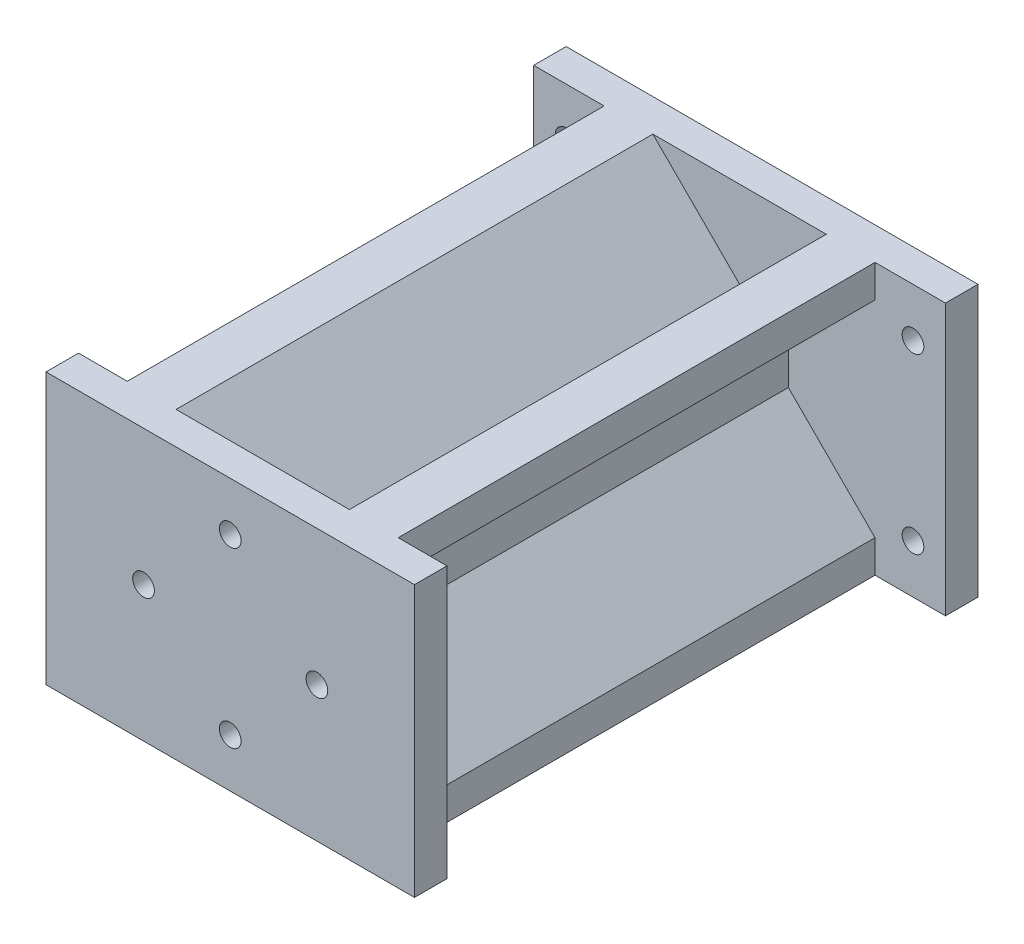
from build123d import *

# Parameters (mm, degrees)
SKETCH_1_W                       = 25
SKETCH_1_H                       = 25
EXTRUDE_1_DEPTH                  = 44
CUT_EXTRUDE_1_DEPTH              = 100
CUT_EXTRUDE_4_DEPTH              = 44
SKETCH_3_W                       = 38
SKETCH_3_H                       = 25
EXTRUDE_2_DEPTH                  = 3
SKETCH_4_R                       = 1
CUT_EXTRUDE_2_DEPTH              = 3
PATTERN_LINEAR_1_COUNT           = 2
PATTERN_LINEAR_1_PITCH           = 32
PATTERN_LINEAR_2_COUNT           = 2
PATTERN_LINEAR_2_PITCH           = 16
PATTERN_LINEAR_2_COPY_1_SKETCH_R = 1
PATTERN_LINEAR_2_COPY_1_DEPTH    = 3
SKETCH_6_W                       = 9.9
SKETCH_6_H                       = 5.8
EXTRUDE_3_DEPTH                  = 3
SKETCH_7_W                       = 34
SKETCH_7_H                       = 25
EXTRUDE_4_DEPTH                  = 3
SKETCH_8_R                       = 1
CUT_EXTRUDE_3_DEPTH              = 3
PATTERN_CIRCULAR_1_COUNT         = 4


with BuildPart() as part:
    # 草图1 → 凸台-拉伸1 (new body)
    with BuildSketch(Plane.XY):
        Rectangle(SKETCH_1_W, SKETCH_1_H)
    extrude(amount=EXTRUDE_1_DEPTH)

    # 草图2 → 切除-拉伸1 (cut)
    with BuildSketch(Plane(origin=(0, 0, 0), x_dir=(-1, 0, 0), z_dir=(0, 0, -1))):
        Polygon((-4.5, 1.5), (-12.5, 9.5), (-12.5, -9.5), (-4.5, -1.5), align=None)
    cut_extrude_1 = extrude(amount=-CUT_EXTRUDE_1_DEPTH, mode=Mode.SUBTRACT)

    # 镜向1: 切除-拉伸1 across plane
    add(cut_extrude_1.mirror(Plane(origin=(0, 0, 0), x_dir=(0, 0, 1), z_dir=(1, 0, 0))), mode=Mode.SUBTRACT)

    # 草图9 → 切除-拉伸4 (cut)
    with BuildSketch(Plane(origin=(0, 0, 0), x_dir=(-1, 0, 0), z_dir=(0, 0, -1))):
        Polygon((-8, 12.5), (0, 4.5), (8, 12.5), align=None)
    cut_extrude_4 = extrude(amount=-CUT_EXTRUDE_4_DEPTH, mode=Mode.SUBTRACT)

    # 镜向2: 切除-拉伸4 across plane
    add(cut_extrude_4.mirror(Plane.ZX), mode=Mode.SUBTRACT)

    # 草图3 → 凸台-拉伸2 (add)
    with BuildSketch(Plane(origin=(0, 0, 0), x_dir=(-1, 0, 0), z_dir=(0, 0, -1))):
        Rectangle(SKETCH_3_W, SKETCH_3_H)
    extrude(amount=EXTRUDE_2_DEPTH)

    # 草图4 → 切除-拉伸2 (cut)
    with BuildSketch(Plane(origin=(0, 0, -3), x_dir=(-1, 0, 0), z_dir=(0, 0, -1))):
        with Locations((-16, 8)):
            Circle(SKETCH_4_R)
    cut_extrude_2 = extrude(amount=-CUT_EXTRUDE_2_DEPTH, mode=Mode.SUBTRACT)

    # 阵列(线性)1: 切除-拉伸2 ×2
    with Locations(*[(-i * PATTERN_LINEAR_1_PITCH, 0, 0) for i in range(1, PATTERN_LINEAR_1_COUNT)]):
        add(cut_extrude_2, mode=Mode.SUBTRACT)

    # 阵列(线性)2: 切除-拉伸2 ×2
    with Locations(*[(0, -i * PATTERN_LINEAR_2_PITCH, 0) for i in range(1, PATTERN_LINEAR_2_COUNT)]):
        add(cut_extrude_2, mode=Mode.SUBTRACT)

    # 阵列(线性)2 copy 1 sketch → 阵列(线性)2 copy 1 (cut)
    with BuildSketch(Plane(origin=(-32, -16, -3), x_dir=(-1, 0, 0), z_dir=(0, 0, -1))):
        with Locations((-16, 8)):
            Circle(PATTERN_LINEAR_2_COPY_1_SKETCH_R)
    extrude(amount=-PATTERN_LINEAR_2_COPY_1_DEPTH, mode=Mode.SUBTRACT)

    # 草图6 → 凸台-拉伸3 (add)
    with BuildSketch(Plane(origin=(0, 0, -3), x_dir=(-1, 0, 0), z_dir=(0, 0, -1))):
        Rectangle(SKETCH_6_W, SKETCH_6_H)
    extrude(amount=EXTRUDE_3_DEPTH)

    # 草图7 → 凸台-拉伸4 (add)
    with BuildSketch(Plane.XY.offset(44)):
        Rectangle(SKETCH_7_W, SKETCH_7_H)
    extrude(amount=EXTRUDE_4_DEPTH)

    # 草图8 → 切除-拉伸3 (cut)
    with BuildSketch(Plane.XY.offset(47)):
        with Locations((0, 8)):
            Circle(SKETCH_8_R)
    cut_extrude_3 = extrude(amount=-CUT_EXTRUDE_3_DEPTH, mode=Mode.SUBTRACT)

    # 阵列(圆周)1: 切除-拉伸3 ×4 about axis
    pattern_circular_1_axis = Axis((0, 0, 0), (0, 0, 1))
    for i in range(1, PATTERN_CIRCULAR_1_COUNT):
        add(cut_extrude_3.rotate(pattern_circular_1_axis, i * 360 / PATTERN_CIRCULAR_1_COUNT), mode=Mode.SUBTRACT)


solid = part.part
